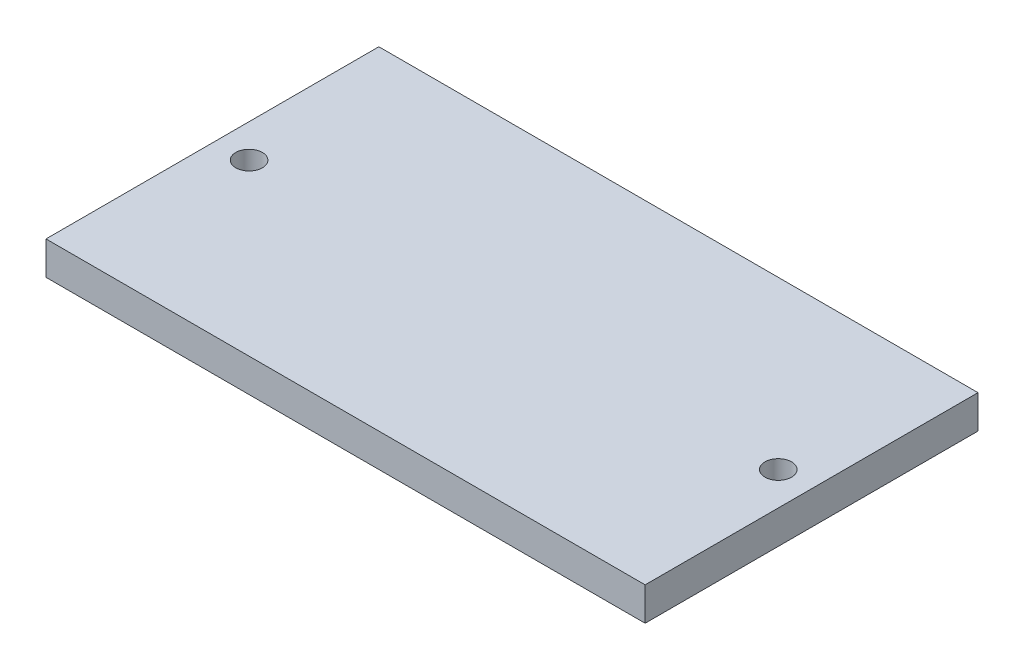
from build123d import *

# Parameters (mm, degrees)
SKETCH_1_W      = 90
SKETCH_1_H      = 50
SKETCH_1_R      = 2
EXTRUDE_1_DEPTH = 5


with BuildPart() as part:
    # 草图1 → 凸台-拉伸1 (new body)
    with BuildSketch(Plane(origin=(0, 0, 0), x_dir=(1, 0, 0), z_dir=(0, 1, 0))):
        Rectangle(SKETCH_1_W, SKETCH_1_H)
        with Locations(Location((-39.996874878, 0.5, 0), (0, 0, 270))):
            Circle(SKETCH_1_R, mode=Mode.SUBTRACT)
        with Locations(Location((40, 0, 0), (0, 0, 270))):
            Circle(SKETCH_1_R, mode=Mode.SUBTRACT)
    extrude(amount=EXTRUDE_1_DEPTH)


solid = part.part
